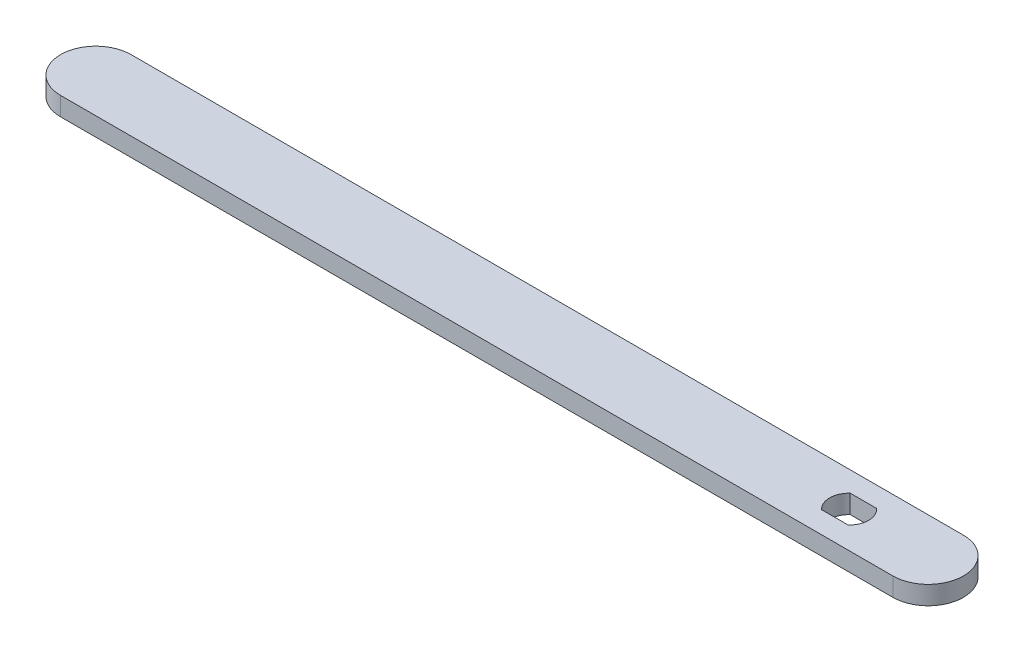
from build123d import *

# Parameters (mm, degrees)
BOSS_EXTRUDE1_DEPTH     = 2.5
CUT_EXTRUDE1_DEPTH      = 106.356743667
CUT_EXTRUDE1_DEPTH_BACK = 106.356743667


with BuildPart() as part:
    # Sketch1 → Boss-Extrude1 (new body)
    with BuildSketch(Plane(origin=(0, 0, 0), x_dir=(1, 0, 0), z_dir=(0, 1, 0))):
        with BuildLine():
            Line((-11.530082988, 4.75), (100.469917012, 4.75))
            ThreePointArc((100.469917012, 4.75), (105.219917012, 0), (100.469917012, -4.75))
            Line((100.469917012, -4.75), (-11.530082988, -4.75))
            ThreePointArc((-11.530082988, -4.75), (-16.280082988, 0), (-11.530082988, 4.75))
        make_face()
    extrude(amount=BOSS_EXTRUDE1_DEPTH)

    # Sketch2 → Cut-Extrude1 (cut, two sides: drawn at the far end of the back side and taken through both)
    with BuildSketch(Plane(origin=(0, 2.5, 0), x_dir=(1, 0, 0), z_dir=(0, 1, 0)).offset(-CUT_EXTRUDE1_DEPTH_BACK)):
        with BuildLine():
            Line((87.954451806, 2.025316283), (91.523765465, 2.025316283))
            ThreePointArc((91.523765465, 2.025316283), (92.364108635, 0.100316283), (91.523765465, -1.824683717))
            Line((91.523765465, -1.824683717), (87.954451806, -1.824683717))
            ThreePointArc((87.954451806, -1.824683717), (87.114108635, 0.100316283), (87.954451806, 2.025316283))
        make_face()
    extrude(amount=CUT_EXTRUDE1_DEPTH + CUT_EXTRUDE1_DEPTH_BACK, mode=Mode.SUBTRACT)


solid = part.part
